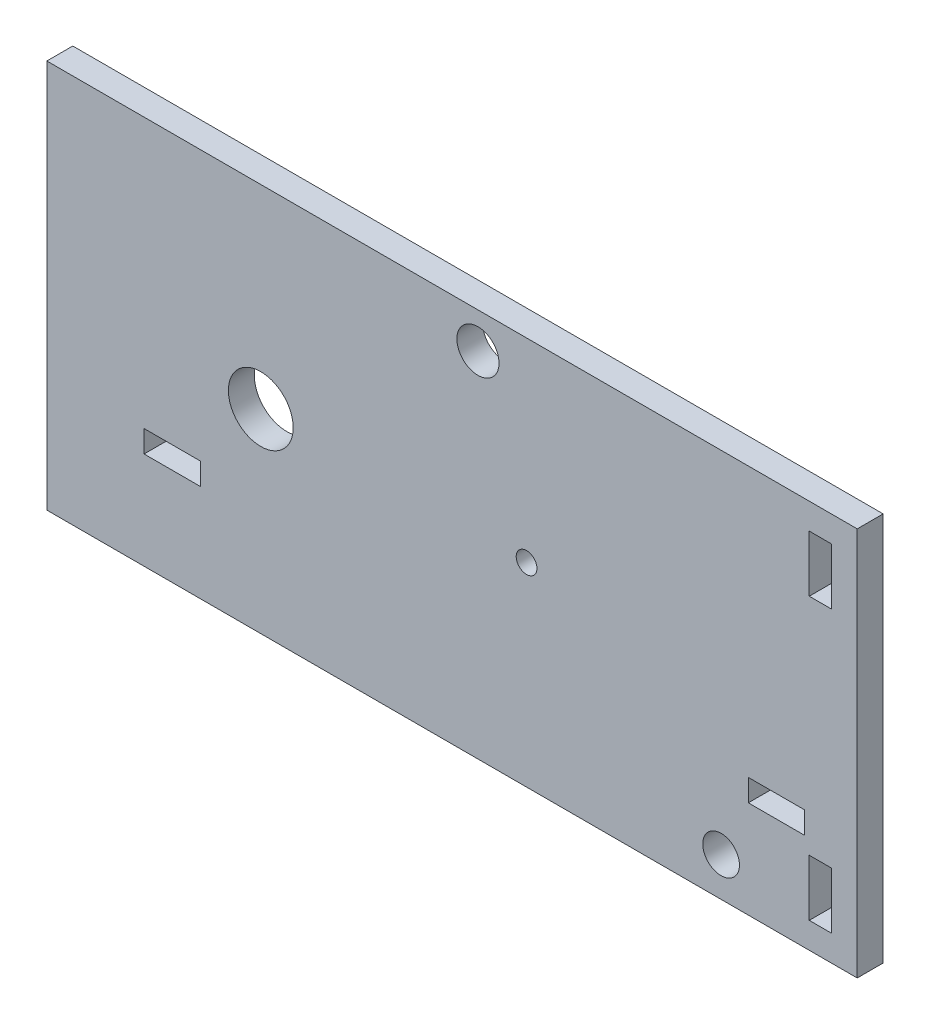
from build123d import *

# Parameters (mm, degrees)
SKETCH1_W               = 121
SKETCH1_H               = 60
SKETCH1_R               = 5
SKETCH1_R_2             = 3.25
SKETCH1_R_3             = 2.83
SKETCH1_R_4             = 1.6
SKETCH1_W_2             = 8.7
SKETCH1_H_2             = 3.4
BOSS_EXTRUDE1_DEPTH     = 4
SKETCH2_W               = 4
SKETCH2_H               = 60
BOSS_EXTRUDE2_DEPTH     = 4
CUT_EXTRUDE2_DEPTH      = 85.599054368
CUT_EXTRUDE2_DEPTH_BACK = 85.599054368
SKETCH3_W               = 3.4
SKETCH3_H               = 8.7


with BuildPart() as part:
    # Sketch1 → Boss-Extrude1 (new body)
    with BuildSketch(Plane.XY):
        with Locations((-18.5, 0)):
            Rectangle(SKETCH1_W, SKETCH1_H)
        with Locations((-46, 0)):
            Circle(SKETCH1_R, mode=Mode.SUBTRACT)
        with Locations((-12.5, 24.5)):
            Circle(SKETCH1_R_2, mode=Mode.SUBTRACT)
        with Locations((25, -24)):
            Circle(SKETCH1_R_3, mode=Mode.SUBTRACT)
        with Locations((-5, 0)):
            Circle(SKETCH1_R_4, mode=Mode.SUBTRACT)
        with Locations((-59.65, -13.3)):
            Rectangle(SKETCH1_W_2, SKETCH1_H_2, mode=Mode.SUBTRACT)
        with Locations((33.55, -13.3)):
            Rectangle(SKETCH1_W_2, SKETCH1_H_2, mode=Mode.SUBTRACT)
    extrude(amount=BOSS_EXTRUDE1_DEPTH)

    # Sketch2 → Boss-Extrude2 (add)
    with BuildSketch(Plane.XY):
        with Locations((44, 0)):
            Rectangle(SKETCH2_W, SKETCH2_H)
    extrude(amount=BOSS_EXTRUDE2_DEPTH)

    # Sketch3 → Cut-Extrude2 (cut, two sides: drawn at the far end of the back side and taken through both)
    with BuildSketch(Plane.XY.offset(-CUT_EXTRUDE2_DEPTH_BACK)):
        with Locations((40.3, 21.65)):
            Rectangle(SKETCH3_W, SKETCH3_H)
        with Locations((40.3, -21.65)):
            Rectangle(SKETCH3_W, SKETCH3_H)
    extrude(amount=CUT_EXTRUDE2_DEPTH + CUT_EXTRUDE2_DEPTH_BACK, mode=Mode.SUBTRACT)


solid = part.part
